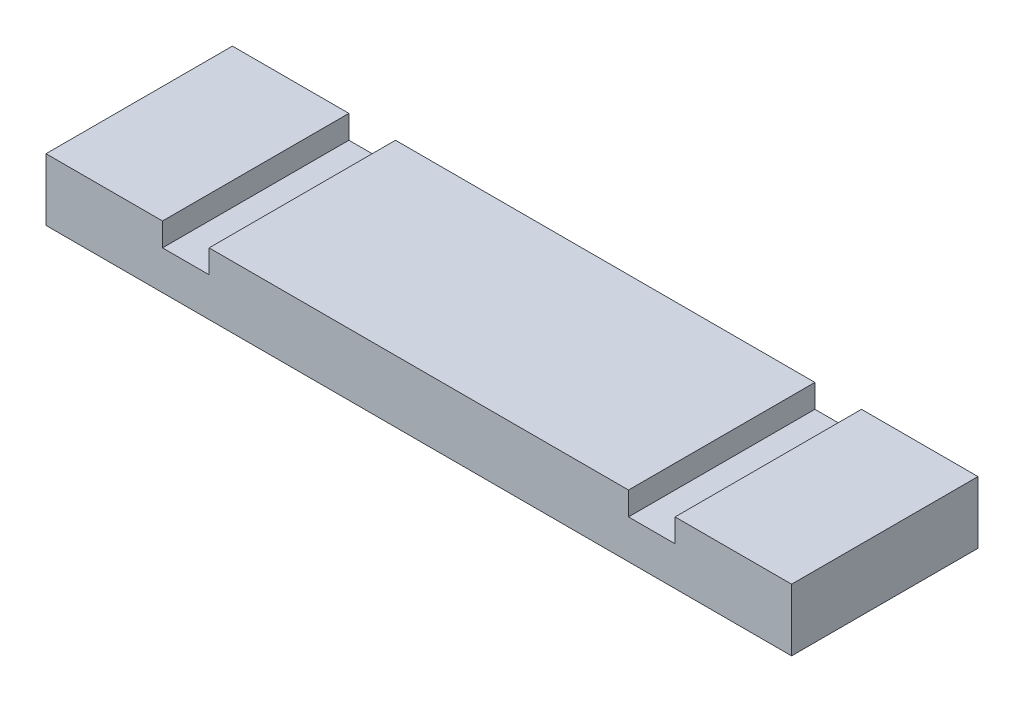
from build123d import *

# Parameters (mm, degrees)
SKETCH1_W           = 48
SKETCH1_H           = 12
BOSS_EXTRUDE1_DEPTH = 4
SKETCH2_W           = 3
SKETCH2_H           = 12
CUT_EXTRUDE1_DEPTH  = 1.5


with BuildPart() as part:
    # Sketch1 → Boss-Extrude1 (new body)
    with BuildSketch(Plane(origin=(0, 0, 0), x_dir=(1, 0, 0), z_dir=(0, 1, 0))):
        Rectangle(SKETCH1_W, SKETCH1_H)
    extrude(amount=BOSS_EXTRUDE1_DEPTH)

    # Sketch2 → Cut-Extrude1 (cut)
    with BuildSketch(Plane(origin=(0, 4, 0), x_dir=(1, 0, 0), z_dir=(0, 1, 0))):
        with Locations((-15, 0)):
            Rectangle(SKETCH2_W, SKETCH2_H)
        with Locations((15, 0)):
            Rectangle(SKETCH2_W, SKETCH2_H)
    extrude(amount=-CUT_EXTRUDE1_DEPTH, mode=Mode.SUBTRACT)


solid = part.part
